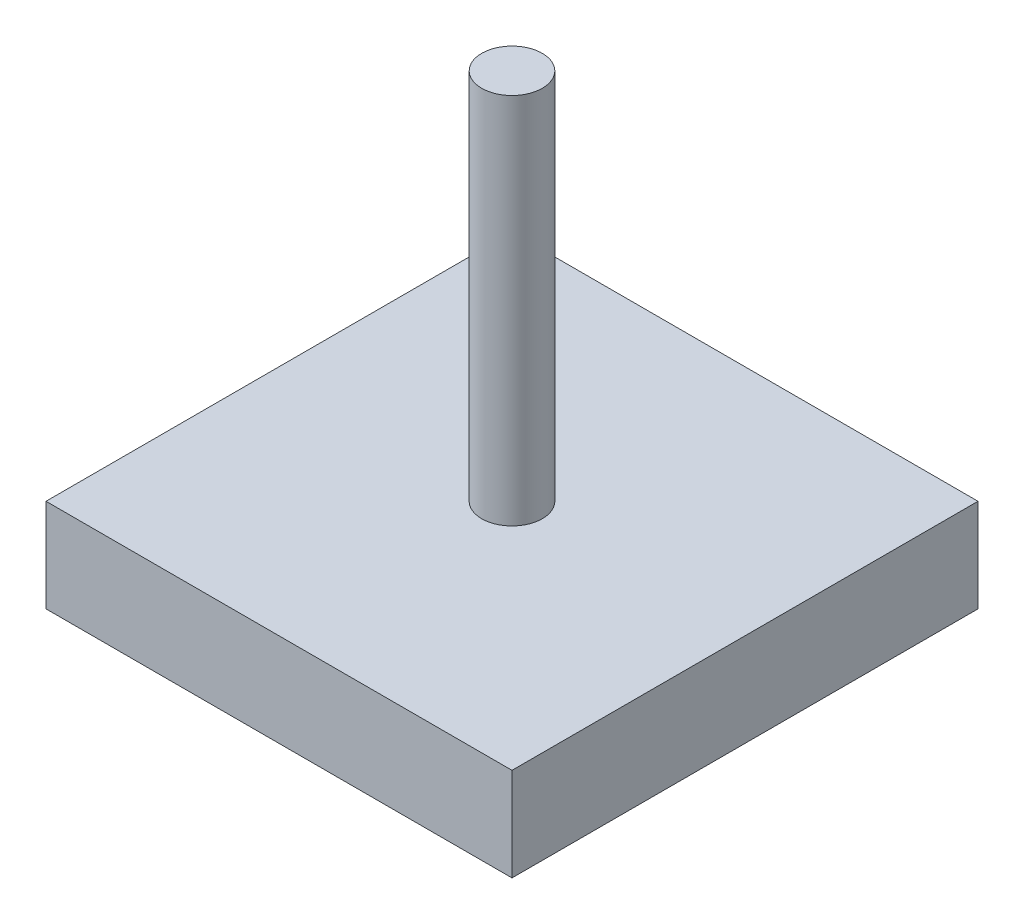
from build123d import *

# Parameters (mm, degrees)
SKETCH1_R           = 3.25
BOSS_EXTRUDE2_DEPTH = 50
SKETCH1_5_W         = 50
SKETCH1_5_H         = 50
SKETCH1_5_R         = 3.25
BOSS_EXTRUDE3_DEPTH = 10


with BuildPart() as part:
    # Sketch1 → Boss-Extrude2 (new body)
    with BuildSketch(Plane(origin=(0, 0, 0), x_dir=(1, 0, 0), z_dir=(0, 1, 0))):
        with Locations((-25, 25)):
            Circle(SKETCH1_R)
    extrude(amount=BOSS_EXTRUDE2_DEPTH)

    # Sketch1<5> → Boss-Extrude3 (add)
    with BuildSketch(Plane(origin=(0, 0, 0), x_dir=(1, 0, 0), z_dir=(0, 1, 0))):
        with Locations((-25, 25)):
            Rectangle(SKETCH1_5_W, SKETCH1_5_H)
        with Locations((-25, 25)):
            Circle(SKETCH1_5_R, mode=Mode.SUBTRACT)
    extrude(amount=BOSS_EXTRUDE3_DEPTH)


solid = part.part
